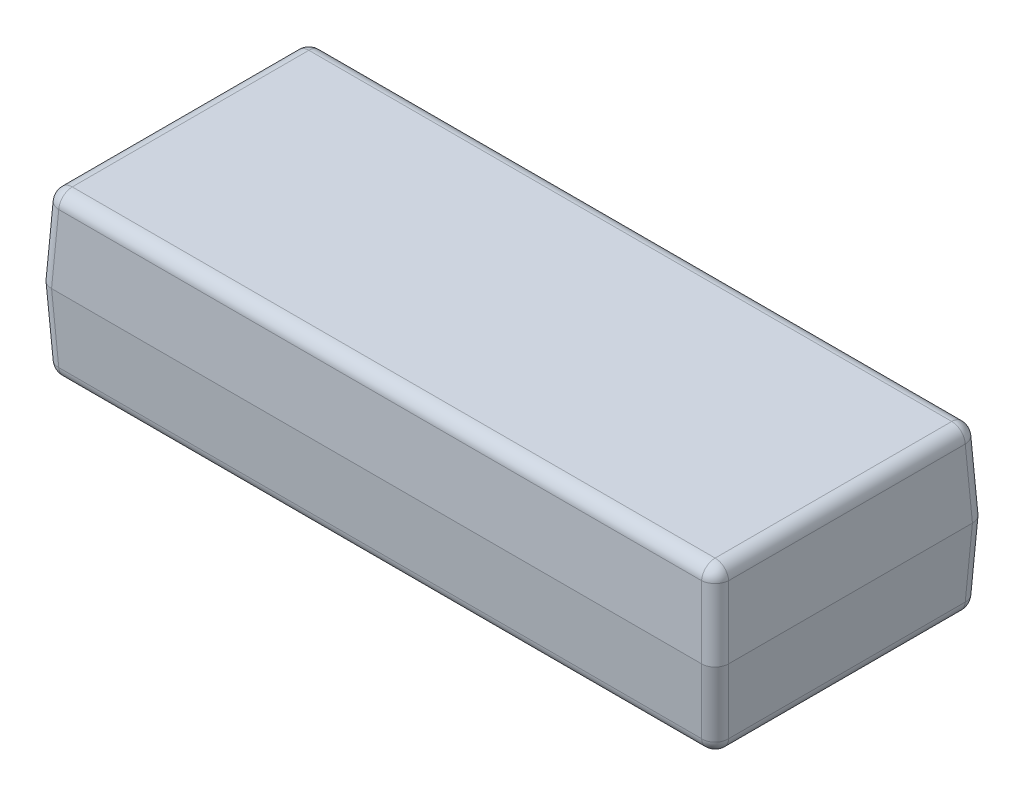
from build123d import *

# Parameters (mm, degrees)
SKETCH1_W           = 125
SKETCH1_H           = 50
BOSS_EXTRUDE1_DEPTH = 15
BOSS_EXTRUDE1_TAPER = 3
FILLET1_R           = 2.5
SKETCH2_W           = 125
SKETCH2_H           = 50
BOSS_EXTRUDE2_DEPTH = 15
BOSS_EXTRUDE2_TAPER = 3
FILLET2_R           = 2.5


with BuildPart() as part:
    # Sketch1 → Boss-Extrude1 (new body)
    with BuildSketch(Plane(origin=(0, 0, 0), x_dir=(1, 0, 0), z_dir=(0, 1, 0))):
        Rectangle(SKETCH1_W, SKETCH1_H)
    extrude(amount=BOSS_EXTRUDE1_DEPTH, taper=BOSS_EXTRUDE1_TAPER)

    # Fillet1
    fillet1_edges = [part.edges().sort_by_distance(p)[0] for p in [
        (-61.713883311, 15, 0),
        (0, 15, 24.213883311),
        (61.713883311, 15, 0),
        (0, 15, -24.213883311),
        (62.106941655, 7.5, 24.606941655),
        (-62.106941655, 7.5, 24.606941655),
        (-62.106941655, 7.5, -24.606941655),
        (62.106941655, 7.5, -24.606941655),
    ]]
    fillet(fillet1_edges, radius=FILLET1_R)


with BuildPart() as body_2:
    # Sketch2 → Boss-Extrude2 (new body)
    with BuildSketch(Plane.XZ):
        Rectangle(SKETCH2_W, SKETCH2_H)
    extrude(amount=BOSS_EXTRUDE2_DEPTH, taper=BOSS_EXTRUDE2_TAPER)

    # Fillet2
    fillet2_edges = [body_2.edges().sort_by_distance(p)[0] for p in [
        (-61.713883311, -15, 0),
        (0, -15, -24.213883311),
        (61.713883311, -15, 0),
        (0, -15, 24.213883311),
        (62.106941655, -7.5, -24.606941655),
        (-62.106941655, -7.5, -24.606941655),
        (-62.106941655, -7.5, 24.606941655),
        (62.106941655, -7.5, 24.606941655),
    ]]
    fillet(fillet2_edges, radius=FILLET2_R)


solid = Compound([part.part, body_2.part])
